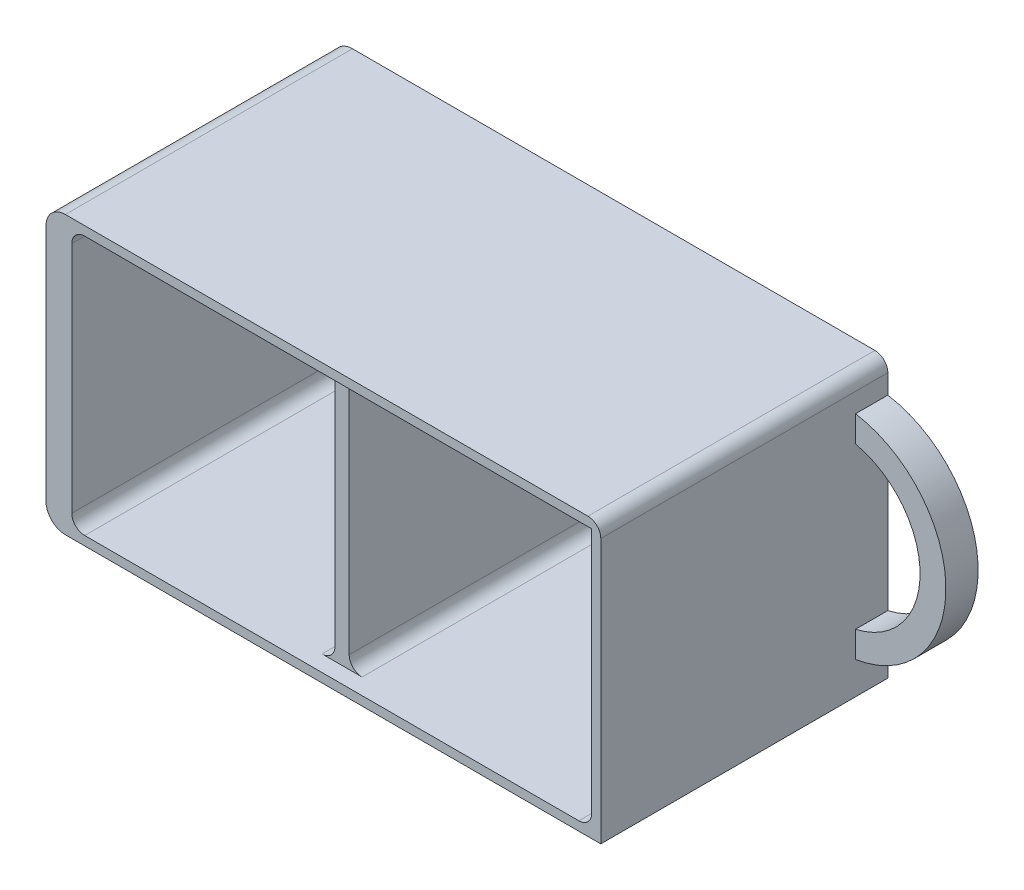
from build123d import *

# Parameters (mm, degrees)
SKETCH_1_W                  = 86
SKETCH_1_H                  = 43
EXTRUDE_1_DEPTH             = 39.5
EXTRUDE_2_DEPTH             = 5
SKETCH_3_W                  = 80.6
SKETCH_3_H                  = 40.2
CUT_EXTRUDE_1_DEPTH         = 43.6
HOLE_WIZARD_8_3_8_3_1_D     = 8.3
HOLE_WIZARD_8_3_8_3_1_DEPTH = 3.2
FILLET_1_R                  = 3
EXTRUDE_START               = -4
SKETCH_6_R                  = 4.15
EXTRUDE_3_DEPTH             = 4
SKETCH_10_W                 = 2.2
SKETCH_10_H                 = 43
EXTRUDE_5_DEPTH             = 42
FILLET_2_R                  = 2


with BuildPart() as part:
    # Эскиз1 → Бобышка-Вытянуть1 (new body)
    with BuildSketch(Plane.XY.offset(22.25)):
        with Locations((47, 0)):
            Rectangle(SKETCH_1_W, SKETCH_1_H)
    extrude(amount=-EXTRUDE_1_DEPTH)

    # Эскиз2 → Бобышка-Вытянуть2 (add)
    with BuildSketch(Plane(origin=(0, 0, -17.25), x_dir=(-1, 0, 0), z_dir=(0, 0, -1))):
        with BuildLine():
            Line((-90, -21.5), (-90, -16.5))
            ThreePointArc((-90, -16.5), (-104, 0), (-90, 16.5))
            Line((-90, 16.5), (-90, 21.5))
            Line((-90, 21.5), (-4, 21.5))
            Line((-4, 21.5), (-4, -21.5))
            Line((-4, -21.5), (-90, -21.5))
        make_face()
        with BuildLine():
            Line((-90, -12.428366172), (-90, 12.428366172))
            ThreePointArc((-90, 12.428366172), (-100, 0), (-90, -12.428366172))
        make_face(mode=Mode.SUBTRACT)
    extrude(amount=EXTRUDE_2_DEPTH)

    # Эскиз3 → Вырез-Вытянуть1 (cut)
    with BuildSketch(Plane.XY.offset(22.25)):
        with Locations((48.3, 0)):
            Rectangle(SKETCH_3_W, SKETCH_3_H)
    extrude(amount=-CUT_EXTRUDE_1_DEPTH, mode=Mode.SUBTRACT)

    # Диаметр отверстия Ø8.3 (8.3)1
    with Locations(Plane.ZY.offset(-4)):
        with Locations((0, 0)):
            Hole(HOLE_WIZARD_8_3_8_3_1_D / 2, depth=HOLE_WIZARD_8_3_8_3_1_DEPTH)

    # Скругление1
    fillet_1_edges = [part.edges().sort_by_distance(p)[0] for p in [
        (4, -21.5, 0),
        (4, 21.5, 0),
    ]]
    fillet(fillet_1_edges, radius=FILLET_1_R)

    # Эскиз6 → Бобышка-Вытянуть3 (add)
    with BuildSketch(Plane.ZY.offset(-4).offset(EXTRUDE_START)):
        Circle(SKETCH_6_R)
    extrude(amount=EXTRUDE_3_DEPTH)

    # Эскиз10 → Бобышка-Вытянуть5 (add)
    with BuildSketch(Plane(origin=(0, 0, -22.25), x_dir=(-1, 0, 0), z_dir=(0, 0, -1))):
        with Locations((-47.4, 0)):
            Rectangle(SKETCH_10_W, SKETCH_10_H)
    extrude(amount=-EXTRUDE_5_DEPTH)

    # Скругление2
    fillet_2_edges = [part.edges().sort_by_distance(p)[0] for p in [
        (27.15, -20.1, -21.35),
        (88.6, -20.1, 0.45),
        (8, 0, -21.35),
        (8, -20.1, 0.45),
        (68.55, 20.1, -21.35),
        (8, 20.1, 0.45),
        (88.6, 0, -21.35),
        (68.55, -20.1, -21.35),
        (27.15, 20.1, -21.35),
        (48.5, 0, -21.35),
        (46.3, 0, -21.35),
        (90, 21.5, 0),
        (46.3, -20.1, -0.8),
        (46.3, 20.1, -0.8),
        (48.5, -20.1, -0.8),
        (48.5, 20.1, -0.8),
    ]]
    fillet(fillet_2_edges, radius=FILLET_2_R)


solid = part.part
